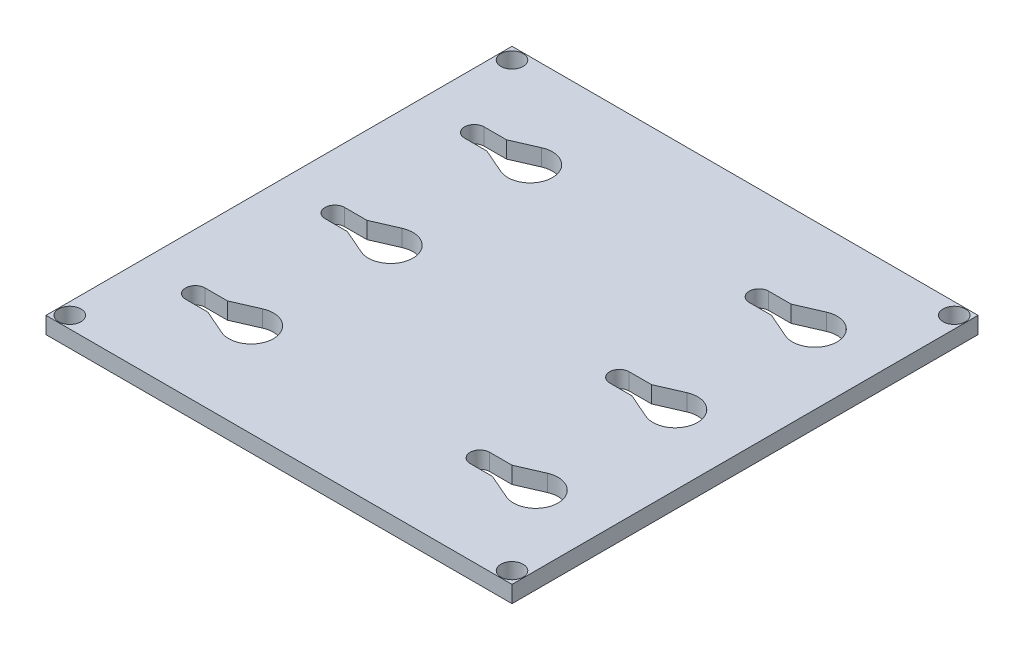
from build123d import *

# Parameters (mm, degrees)
SCHIZZO1_W                   = 83.5
SCHIZZO1_H                   = 83.5
ESTRUSIONE_ESTRUSIONE1_DEPTH = 3
SCHIZZO2_R                   = 2
TAGLIO_ESTRUSIONE1_DEPTH     = 3
TAGLIO_ESTRUSIONE2_DEPTH     = 60.119582204
RIPETIZIONE_A_L1_COUNT       = 2
RIPETIZIONE_A_L1_PITCH       = 51
RIPETIZIONE_A_L1_COUNT_DIR2  = 2
RIPETIZIONE_A_L1_PITCH_DIR2  = 25
SPECCHIA1_COPY_1_DEPTH       = 60.119582204
SPECCHIA1_COPY_2_DEPTH       = 60.119582204
SPECCHIA1_COPY_3_DEPTH       = 60.119582204
SPECCHIA1_COPY_4_DEPTH       = 60.119582204


with BuildPart() as part:
    # Schizzo1 → Estrusione-Estrusione1 (new body)
    with BuildSketch(Plane(origin=(0, 0, 0), x_dir=(1, 0, 0), z_dir=(0, 1, 0))):
        Rectangle(SCHIZZO1_W, SCHIZZO1_H)
    extrude(amount=ESTRUSIONE_ESTRUSIONE1_DEPTH)

    # Schizzo2 → Taglio-Estrusione1 (cut)
    with BuildSketch(Plane(origin=(0, 0, 0), x_dir=(-1, 0, 0), z_dir=(0, -1, 0))):
        with Locations(Location((39.621320344, 39.621320344, 0), (0, 0, 90))):
            Circle(SCHIZZO2_R)
        with Locations(Location((39.621320344, -39.621320344, 0), (0, 0, 90))):
            Circle(SCHIZZO2_R)
        with Locations(Location((-39.621320344, 39.621320344, 0), (0, 0, 90))):
            Circle(SCHIZZO2_R)
        with Locations(Location((-39.621320344, -39.621320344, 0), (0, 0, 90))):
            Circle(SCHIZZO2_R)
    extrude(amount=-TAGLIO_ESTRUSIONE1_DEPTH, mode=Mode.SUBTRACT)

    # Schizzo4 → Taglio-Estrusione2 (cut, through all)
    with BuildSketch(Plane.XZ):
        with BuildLine():
            Line((-27.75, 1.75), (-31.75, 1.75))
            ThreePointArc((-31.75, 1.75), (-33.5, 0), (-31.75, -1.75))
            Line((-31.75, -1.75), (-27.75, -1.75))
            Line((-27.75, -1.75), (-23.347020102, -3.667359649))
            ThreePointArc((-23.347020102, -3.667359649), (-17.75, 0), (-23.347020102, 3.667359649))
            Line((-23.347020102, 3.667359649), (-27.75, 1.75))
        make_face()
    taglio_estrusione2 = extrude(amount=-TAGLIO_ESTRUSIONE2_DEPTH, mode=Mode.SUBTRACT)

    # Ripetizione a L1: Taglio-Estrusione2 2 × 2
    with Locations(*[(i * RIPETIZIONE_A_L1_PITCH, 0, -j * RIPETIZIONE_A_L1_PITCH_DIR2) for i in range(RIPETIZIONE_A_L1_COUNT) for j in range(RIPETIZIONE_A_L1_COUNT_DIR2) if (i, j) != (0, 0)]):
        add(taglio_estrusione2, mode=Mode.SUBTRACT)

    # Specchia1 copy 1 sketch → Specchia1 copy 1 (cut, through all)
    with BuildSketch(Plane(origin=(0, 0, 25), x_dir=(1, 0, 0), z_dir=(0, -1, 0))):
        with BuildLine():
            Line((-27.75, -1.75), (-31.75, -1.75))
            ThreePointArc((-31.75, -1.75), (-33.5, 0), (-31.75, 1.75))
            Line((-31.75, 1.75), (-27.75, 1.75))
            Line((-27.75, 1.75), (-23.347020102, 3.667359649))
            ThreePointArc((-23.347020102, 3.667359649), (-17.75, 0), (-23.347020102, -3.667359649))
            Line((-23.347020102, -3.667359649), (-27.75, -1.75))
        make_face()
    extrude(amount=-SPECCHIA1_COPY_1_DEPTH, mode=Mode.SUBTRACT)

    # Specchia1 copy 2 sketch → Specchia1 copy 2 (cut, through all)
    with BuildSketch(Plane(origin=(51, 0, 0), x_dir=(1, 0, 0), z_dir=(0, -1, 0))):
        with BuildLine():
            Line((-27.75, -1.75), (-31.75, -1.75))
            ThreePointArc((-31.75, -1.75), (-33.5, 0), (-31.75, 1.75))
            Line((-31.75, 1.75), (-27.75, 1.75))
            Line((-27.75, 1.75), (-23.347020102, 3.667359649))
            ThreePointArc((-23.347020102, 3.667359649), (-17.75, 0), (-23.347020102, -3.667359649))
            Line((-23.347020102, -3.667359649), (-27.75, -1.75))
        make_face()
    extrude(amount=-SPECCHIA1_COPY_2_DEPTH, mode=Mode.SUBTRACT)

    # Specchia1 copy 3 sketch → Specchia1 copy 3 (cut, through all)
    with BuildSketch(Plane(origin=(51, 0, 25), x_dir=(1, 0, 0), z_dir=(0, -1, 0))):
        with BuildLine():
            Line((-27.75, -1.75), (-31.75, -1.75))
            ThreePointArc((-31.75, -1.75), (-33.5, 0), (-31.75, 1.75))
            Line((-31.75, 1.75), (-27.75, 1.75))
            Line((-27.75, 1.75), (-23.347020102, 3.667359649))
            ThreePointArc((-23.347020102, 3.667359649), (-17.75, 0), (-23.347020102, -3.667359649))
            Line((-23.347020102, -3.667359649), (-27.75, -1.75))
        make_face()
    extrude(amount=-SPECCHIA1_COPY_3_DEPTH, mode=Mode.SUBTRACT)

    # Specchia1 copy 4 sketch → Specchia1 copy 4 (cut, through all)
    with BuildSketch(Plane.XZ):
        with BuildLine():
            Line((-27.75, -1.75), (-31.75, -1.75))
            ThreePointArc((-31.75, -1.75), (-33.5, 0), (-31.75, 1.75))
            Line((-31.75, 1.75), (-27.75, 1.75))
            Line((-27.75, 1.75), (-23.347020102, 3.667359649))
            ThreePointArc((-23.347020102, 3.667359649), (-17.75, 0), (-23.347020102, -3.667359649))
            Line((-23.347020102, -3.667359649), (-27.75, -1.75))
        make_face()
    extrude(amount=-SPECCHIA1_COPY_4_DEPTH, mode=Mode.SUBTRACT)


solid = part.part
